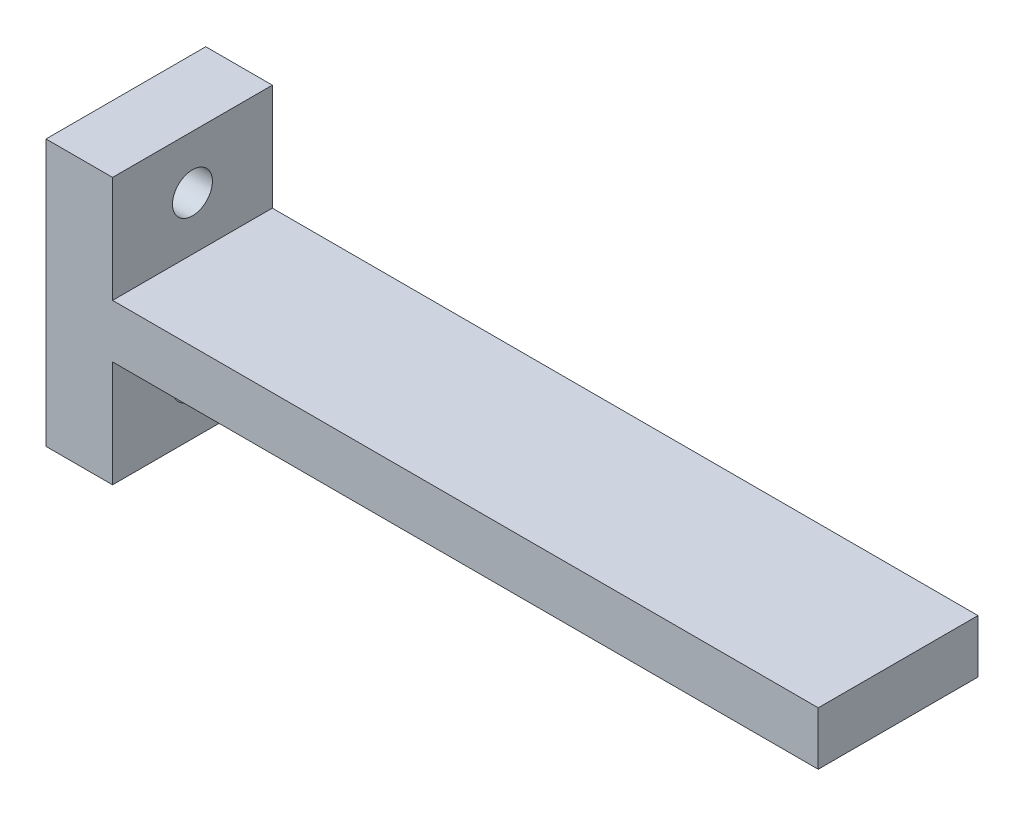
from build123d import *

# Parameters (mm, degrees)
SKETCH_1_W      = 53
SKETCH_1_H      = 12
EXTRUDE_1_DEPTH = 2
SKETCH_2_W      = 12
SKETCH_2_H      = 20
SKETCH_2_R      = 1.5
EXTRUDE_2_DEPTH = 5


with BuildPart() as part:
    # 草图1 → 凸台-拉伸1 (new, symmetric)
    with BuildSketch(Plane(origin=(0, 0, 0), x_dir=(1, 0, 0), z_dir=(0, 1, 0))):
        Rectangle(SKETCH_1_W, SKETCH_1_H)
    extrude(amount=EXTRUDE_1_DEPTH, both=True)

    # 草图2 → 凸台-拉伸2 (add)
    with BuildSketch(Plane.ZY.offset(26.5)):
        Rectangle(SKETCH_2_W, SKETCH_2_H)
        with Locations((0, 6)):
            Circle(SKETCH_2_R, mode=Mode.SUBTRACT)
        with Locations((0, -6)):
            Circle(SKETCH_2_R, mode=Mode.SUBTRACT)
    extrude(amount=EXTRUDE_2_DEPTH)


solid = part.part
